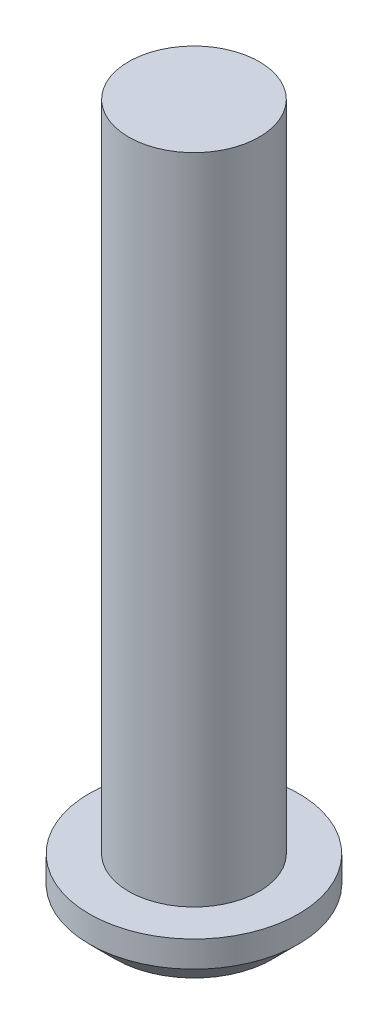
from build123d import *

# Parameters (mm, degrees)
SKETCH1_R                   = 4
BOSS_EXTRUDE1_DEPTH         = 2
SKETCH2_R                   = 2.5
BOSS_EXTRUDE2_DEPTH         = 25
M2_TAPPED_HOLE1_D           = 1.6
M2_TAPPED_HOLE1_DEPTH       = 8
M2_TAPPED_HOLE1_CSINK_D     = 2.05
M2_TAPPED_HOLE1_CSINK_ANGLE = 90
M2_TAPPED_HOLE1_TIP         = 0.480688495
CHAMFER1_SIZE               = 1


with BuildPart() as part:
    # Sketch1 → Boss-Extrude1 (new body)
    with BuildSketch(Plane(origin=(0, 0, 0), x_dir=(1, 0, 0), z_dir=(0, 1, 0))):
        with Locations(Location((0, 0, 0), (0, 0, 270))):
            Circle(SKETCH1_R)
    extrude(amount=BOSS_EXTRUDE1_DEPTH)

    # Sketch2 → Boss-Extrude2 (add)
    with BuildSketch(Plane(origin=(0, 2, 0), x_dir=(1, 0, 0), z_dir=(0, 1, 0))):
        with Locations(Location((0, 0, 0), (0, 0, 270))):
            Circle(SKETCH2_R)
    extrude(amount=BOSS_EXTRUDE2_DEPTH)

    # M2 Tapped Hole1
    with Locations(Plane(origin=(0, 0, 0), x_dir=(-1, 0, 0), z_dir=(0, -1, 0))):
        with Locations((0, 0)):
            CounterSinkHole(M2_TAPPED_HOLE1_D / 2, M2_TAPPED_HOLE1_CSINK_D / 2, depth=M2_TAPPED_HOLE1_DEPTH, counter_sink_angle=M2_TAPPED_HOLE1_CSINK_ANGLE)
            with Locations((0, 0, -(M2_TAPPED_HOLE1_DEPTH + M2_TAPPED_HOLE1_TIP / 2))):  # 118° drill point
                Cone(0, M2_TAPPED_HOLE1_D / 2, M2_TAPPED_HOLE1_TIP, mode=Mode.SUBTRACT)

    # Chamfer1
    chamfer1_edges = [part.edges().sort_by_distance(p)[0] for p in [
        (0, 0, -4),
    ]]
    chamfer(chamfer1_edges, length=CHAMFER1_SIZE)


solid = part.part
